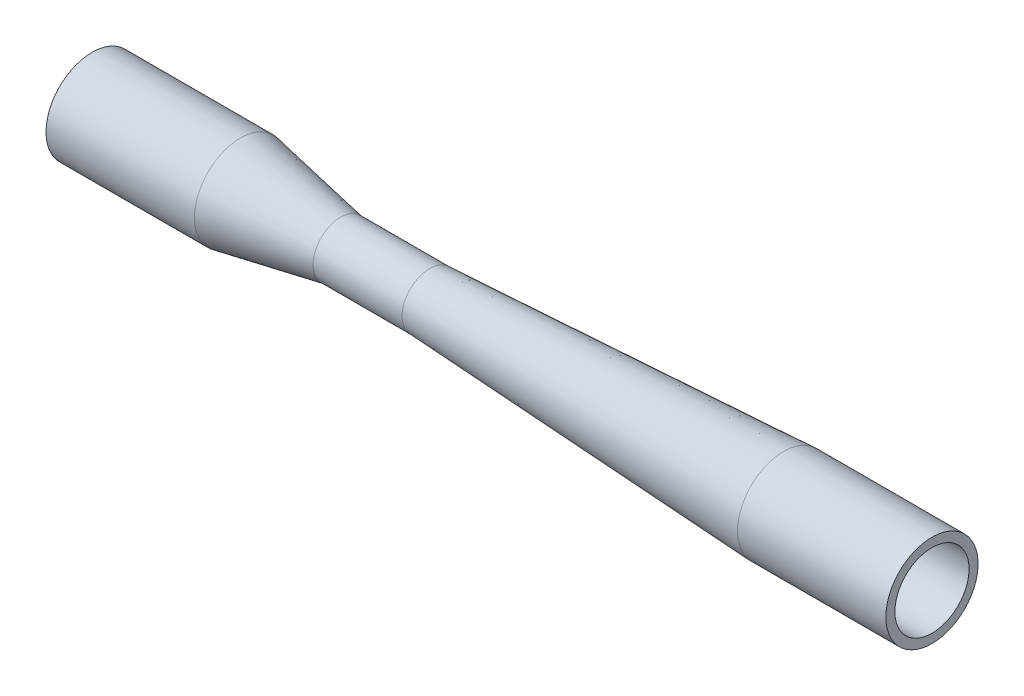
from build123d import *


with BuildPart() as part:
    # Sketch1 → Revolve1 (revolve)
    with BuildSketch(Plane.XY, mode=Mode.PRIVATE) as revolve1_sk:
        Polygon((0, 12.5), (50, 12.5), (83.721982339, 6.25), (113.721982339, 6.25), (232.979086638, 12.5), (282.979086638, 12.5), (282.979086638, 15.535646824), (232.979086638, 15.535646824), (113.721982339, 9.285646824), (83.721982339, 9.285646824), (50, 15.535646824), (0, 15.535646824), align=None)
    revolve(revolve1_sk.sketch.rotate(Axis((-187.472436386, 0, 0), (1, 0, 0)), 90), axis=Axis((-187.472436386, 0, 0), (1, 0, 0)))


solid = part.part
